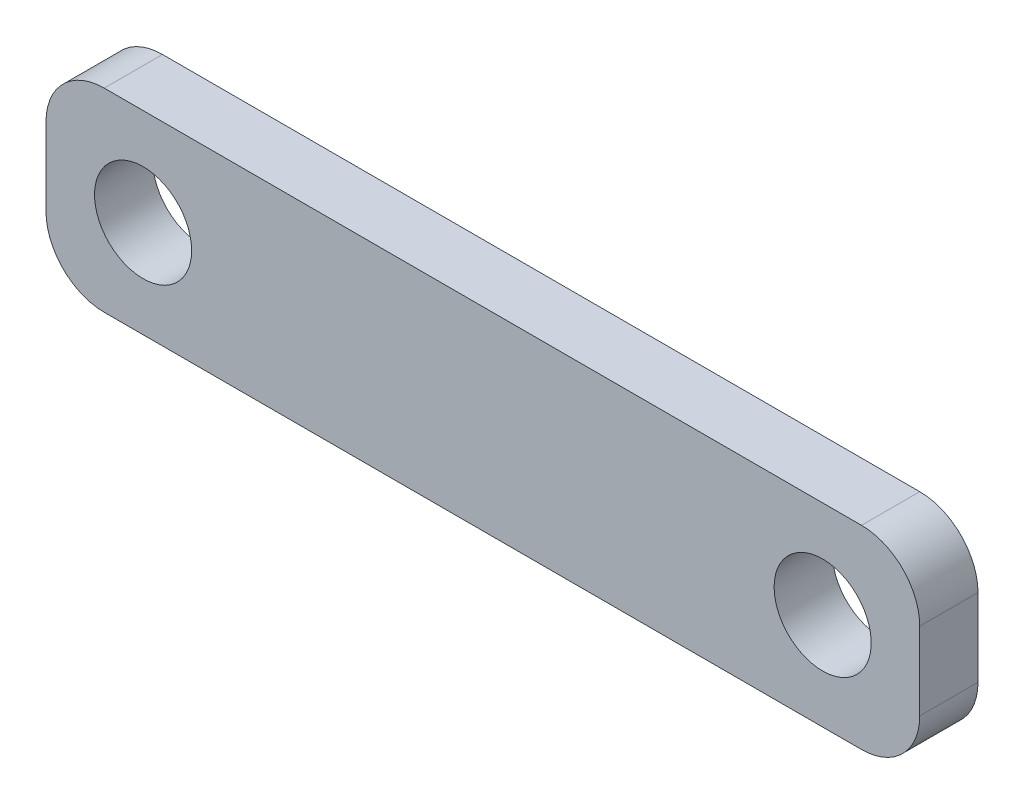
from build123d import *

# Parameters (mm, degrees)
SKETCH_1_R      = 2.5
EXTRUDE_1_DEPTH = 3


with BuildPart() as part:
    # 草图1 → 凸台-拉伸1 (new body)
    with BuildSketch(Plane.XY):
        with BuildLine():
            Line((-19.5, -5), (19.5, -5))
            ThreePointArc((19.5, -5), (21.621320344, -4.121320344), (22.5, -2))
            Line((22.5, -2), (22.5, 2))
            ThreePointArc((22.5, 2), (21.621320344, 4.121320344), (19.5, 5))
            Line((19.5, 5), (-19.5, 5))
            ThreePointArc((-19.5, 5), (-21.621320344, 4.121320344), (-22.5, 2))
            Line((-22.5, 2), (-22.5, -2))
            ThreePointArc((-22.5, -2), (-21.621320344, -4.121320344), (-19.5, -5))
        make_face()
        with Locations((-17.5, 0)):
            Circle(SKETCH_1_R, mode=Mode.SUBTRACT)
        with Locations(Location((17.5, 0, 0), (0, 0, 180))):
            Circle(SKETCH_1_R, mode=Mode.SUBTRACT)
    extrude(amount=EXTRUDE_1_DEPTH)


solid = part.part
